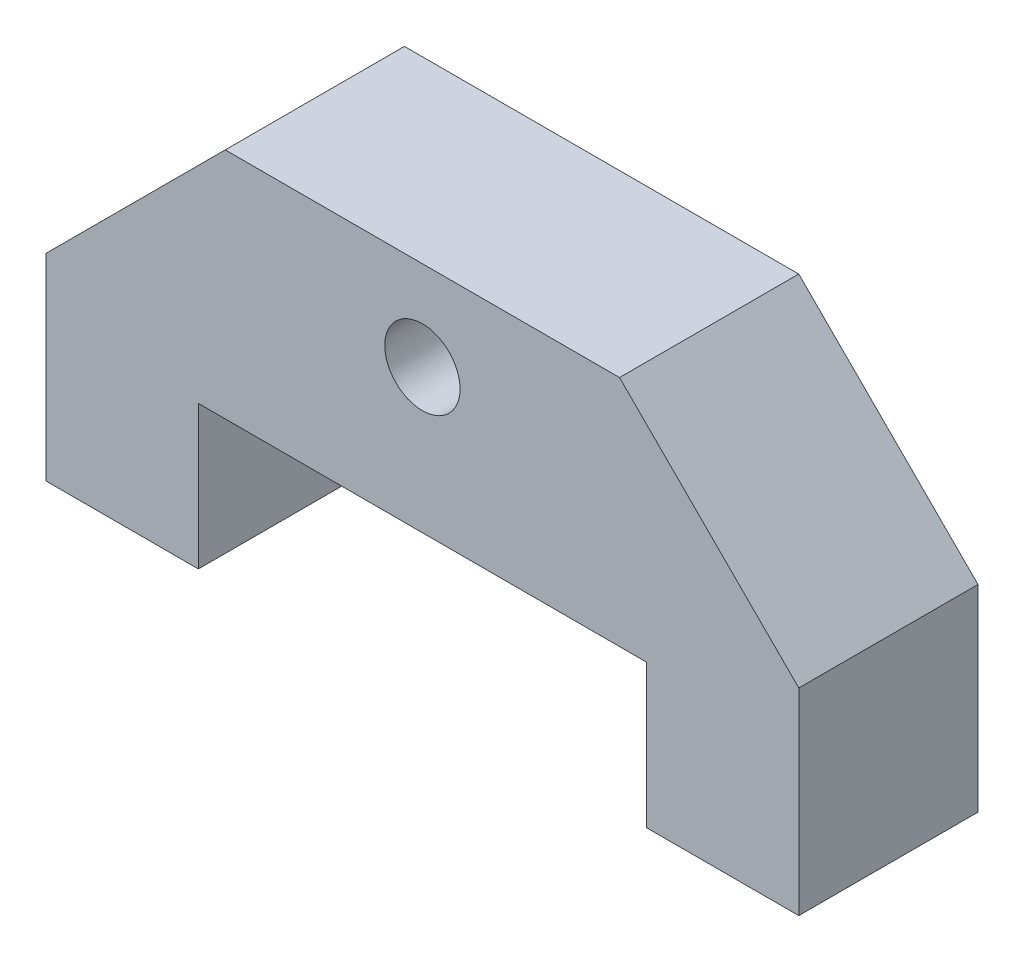
from build123d import *

# Parameters (mm, degrees)
SKETCH_1_W             = 42
SKETCH_1_H             = 21
EXTRUDE_1_DEPTH        = 5
SKETCH_2_W             = 25
SKETCH_2_H             = 8
CUT_EXTRUDE_1_DEPTH    = 26.51960031
HOLE_WIZARD_M4_1_D     = 3.3
HOLE_WIZARD_M4_1_DEPTH = 10.1
HOLE_WIZARD_M4_1_TIP   = 0.991420021
HOLE_WIZARD_M5_1_D     = 4.2
CHAMFER_1_SIZE         = 10


with BuildPart() as part:
    # 草图1 → 凸台-拉伸1 (new, symmetric)
    with BuildSketch(Plane.XY):
        Rectangle(SKETCH_1_W, SKETCH_1_H)
    extrude(amount=EXTRUDE_1_DEPTH, both=True)

    # 草图2 → 切除-拉伸1 (cut, through all)
    with BuildSketch(Plane.XY.offset(5)):
        with Locations((0, -6.5)):
            Rectangle(SKETCH_2_W, SKETCH_2_H)
    extrude(amount=-CUT_EXTRUDE_1_DEPTH, mode=Mode.SUBTRACT)

    # M4 螺纹孔1
    with Locations(Plane(origin=(0, -10.5, 0), x_dir=(-1, 0, 0), z_dir=(0, -1, 0))):
        with Locations((16, 0), (-16, 0)):
            Hole(HOLE_WIZARD_M4_1_D / 2, depth=HOLE_WIZARD_M4_1_DEPTH)
            with Locations((0, 0, -(HOLE_WIZARD_M4_1_DEPTH + HOLE_WIZARD_M4_1_TIP / 2))):  # 118° drill point
                Cone(0, HOLE_WIZARD_M4_1_D / 2, HOLE_WIZARD_M4_1_TIP, mode=Mode.SUBTRACT)

    # M5 螺纹孔1 (through all)
    with Locations(Plane.XY.offset(5)):
        with Locations((0, 5.5)):
            Hole(HOLE_WIZARD_M5_1_D / 2)

    # 倒角1
    chamfer_1_edges = [part.edges().sort_by_distance(p)[0] for p in [
        (-21, 10.5, 0),
        (21, 10.5, 0),
    ]]
    chamfer(chamfer_1_edges, length=CHAMFER_1_SIZE)


solid = part.part
